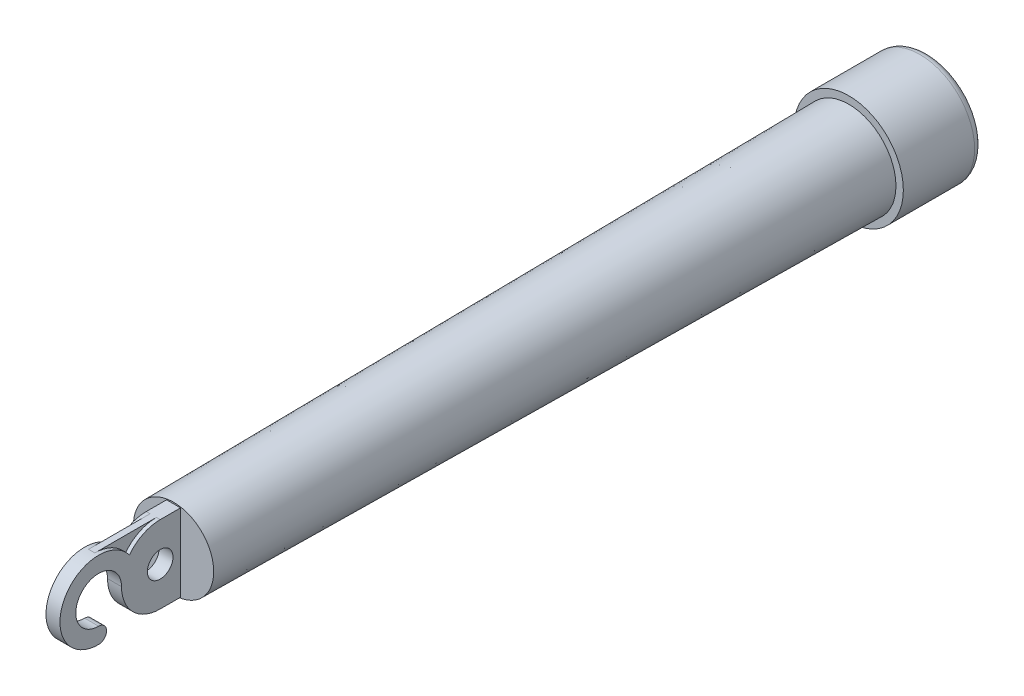
from build123d import *
from build123d.topology import SkipClean

# Parameters (mm, degrees)
SKETCH1_R           = 9.375
END_CAP_MAIN_DEPTH  = 13.65
FILLET1_R           = 1.4
SKETCH2_R           = 4.4
END_CAP_CUT_DEPTH   = 9.3
FILLET2_R           = 1
SKETCH16_R          = 8.105
CUT_EXTRUDE12_DEPTH = 2.5
SKETCH5_3_R         = 8.105
BOSS_EXTRUDE4_DEPTH = 2.5
SKETCH4_R           = 6.9
SKETCH5_R           = 8.105
SKETCH6_W           = 2.4
SKETCH6_H           = 13.3
BOSS_EXTRUDE2_DEPTH = 20.72
CUT_EXTRUDE2_REACH  = 153.053
CUT_EXTRUDE4_DEPTH  = 0.655
CUT_EXTRUDE9_REACH  = 153.052
CUT_EXTRUDE10_REACH = 153.052
BOSS_EXTRUDE3_DEPTH = 2.4
CUT_EXTRUDE11_REACH = 153.052
SKETCH15_R          = 2.2


with BuildPart() as part:
    # Sketch1 → End Cap Main (new body)
    with BuildSketch(Plane.XY):
        Circle(SKETCH1_R)
    extrude(amount=END_CAP_MAIN_DEPTH)

    # Fillet1
    fillet1_edges = [part.edges().sort_by_distance(p)[0] for p in [
        (-9.375, 0, 0),
    ]]
    fillet(fillet1_edges, radius=FILLET1_R)

    # Sketch2 → End Cap cut (cut)
    with BuildSketch(Plane(origin=(0, 0, 0), x_dir=(-1, 0, 0), z_dir=(0, 0, -1))):
        Circle(SKETCH2_R)
    extrude(amount=-END_CAP_CUT_DEPTH, mode=Mode.SUBTRACT)

    # Fillet2
    fillet2_edges = [part.edges().sort_by_distance(p)[0] for p in [
        (4.4, 0, 0),
    ]]
    fillet(fillet2_edges, radius=FILLET2_R)

    # Sketch16 → Cut-Extrude12 (cut)
    with BuildSketch(Plane.XY.offset(13.65)):
        Circle(SKETCH16_R)
    extrude(amount=-CUT_EXTRUDE12_DEPTH, mode=Mode.SUBTRACT)

    # Sketch5<3> → Boss-Extrude4 (add)
    with BuildSketch(Plane.XY.offset(13.65)):
        Circle(SKETCH5_3_R)
    extrude(amount=-BOSS_EXTRUDE4_DEPTH)

    # Sketch4 → Loft1 section 0
    with BuildSketch(Plane.XY.offset(129.67)):
        Circle(SKETCH4_R)
    # Sketch5 → Loft1 section 1
    with BuildSketch(Plane.XY.offset(13.65)):
        Circle(SKETCH5_R)
    loft()

    # Sketch6 → Boss-Extrude2 (add)
    with BuildSketch(Plane.XY.offset(129.67)):
        Rectangle(SKETCH6_W, SKETCH6_H)
    extrude(amount=BOSS_EXTRUDE2_DEPTH)

    # Sketch9 → Cut-Extrude2 (cut, up to next)
    with BuildSketch(Plane(origin=(1.2, 0, 0), x_dir=(0, 0, -1), z_dir=(1, 0, 0)), mode=Mode.PRIVATE) as cut_extrude2_sk1:
        with BuildLine():
            Line((-150.39, 6.65), (-150.39, -6.65))
            Line((-150.39, -6.65), (-143.73925134, -6.65))
            ThreePointArc((-143.73925134, -6.65), (-150.38925134, 0), (-143.73925134, 6.65))
            Line((-143.73925134, 6.65), (-150.39, 6.65))
        make_face()
    cut_extrude2_tool1 = extrude(cut_extrude2_sk1.sketch, amount=-CUT_EXTRUDE2_REACH, mode=Mode.PRIVATE) & part.part
    add(cut_extrude2_tool1.solids().sort_by_distance((1.2, 6.501298, 147.064626))[0], mode=Mode.SUBTRACT)

    # Sketch10 → Cut-Extrude4 (cut)
    with SkipClean():  # the faces are left unmerged after this step: merging them gives an invalid solid
        with BuildSketch(Plane(origin=(1.2, 0, 0), x_dir=(0, 0, -1), z_dir=(1, 0, 0))):
            with BuildLine():
                Line((-143.73925134, 6.65), (-133.16425134, 6.65))
                ThreePointArc((-133.16425134, 6.65), (-136.114103218, 5.959939085), (-138.45175134, 4.032969594))
                ThreePointArc((-138.45175134, 4.032969594), (-140.789399463, 5.959939085), (-143.73925134, 6.65))
            make_face()
        cut_extrude4 = extrude(amount=-CUT_EXTRUDE4_DEPTH, mode=Mode.SUBTRACT)

    # Mirror1: Cut-Extrude4 across plane
    with SkipClean():  # the faces are left unmerged after this step: merging them gives an invalid solid
        add(cut_extrude4.mirror(Plane(origin=(0, 0, 0), x_dir=(0, 0, 1), z_dir=(1, 0, 0))), mode=Mode.SUBTRACT)

    # Sketch12 → Cut-Extrude9 (cut, up to next)
    with BuildSketch(Plane(origin=(1.2, 0, 0), x_dir=(0, 0, -1), z_dir=(1, 0, 0)), mode=Mode.PRIVATE) as cut_extrude9_sk1:
        with BuildLine():
            Line((-143.73925134, -3.925), (-143.73925134, -6.65))
            Line((-143.73925134, -6.65), (-139.81425134, -6.65))
            Line((-139.81425134, -6.65), (-139.81425134, 0))
            ThreePointArc((-139.81425134, 0), (-146.514645456, 2.775394116), (-143.73925134, -3.925))
        make_face()
    cut_extrude9_tool1 = extrude(cut_extrude9_sk1.sketch, amount=-CUT_EXTRUDE9_REACH, mode=Mode.PRIVATE) & part.part
    add(cut_extrude9_tool1.solids().sort_by_distance((1.2, -1.067806, 143.241366))[0], mode=Mode.SUBTRACT)

    # Sketch13 → Cut-Extrude10 (cut, up to next)
    with BuildSketch(Plane(origin=(1.2, 0, 0), x_dir=(0, 0, -1), z_dir=(1, 0, 0)), mode=Mode.PRIVATE) as cut_extrude10_sk1:
        with BuildLine():
            Line((-139.81425134, 0), (-139.81425134, -6.65))
            Line((-139.81425134, -6.65), (-133.16425134, -6.65))
            ThreePointArc((-133.16425134, -6.65), (-137.866511435, -4.702260095), (-139.81425134, 0))
        make_face()
    cut_extrude10_tool1 = extrude(cut_extrude10_sk1.sketch, amount=-CUT_EXTRUDE10_REACH, mode=Mode.PRIVATE) & part.part
    add(cut_extrude10_tool1.solids().sort_by_distance((1.2, -5.164603, 138.328855))[0], mode=Mode.SUBTRACT)

    # Sketch14 → Boss-Extrude3 (add)
    with SkipClean():  # the faces are left unmerged after this step: merging them gives an invalid solid
        with BuildSketch(Plane(origin=(1.2, 0, 0), x_dir=(0, 0, -1), z_dir=(1, 0, 0))):
            with BuildLine():
                Line((-143.73925134, -3.925), (-143.73925134, -6.65))
                ThreePointArc((-143.73925134, -6.65), (-142.37675134, -5.2875), (-143.73925134, -3.925))
            make_face()
        extrude(amount=-BOSS_EXTRUDE3_DEPTH)

    # Sketch15 → Cut-Extrude11 (cut, up to next)
    with BuildSketch(Plane(origin=(1.2, 0, 0), x_dir=(0, 0, -1), z_dir=(1, 0, 0)), mode=Mode.PRIVATE) as cut_extrude11_sk1:
        with Locations((-133.16425134, 0)):
            Circle(SKETCH15_R)
    cut_extrude11_tool1 = extrude(cut_extrude11_sk1.sketch, amount=-CUT_EXTRUDE11_REACH, mode=Mode.PRIVATE) & part.part
    add(cut_extrude11_tool1.solids().sort_by_distance((1.2, 0, 133.164251))[0], mode=Mode.SUBTRACT)


solid = part.part
